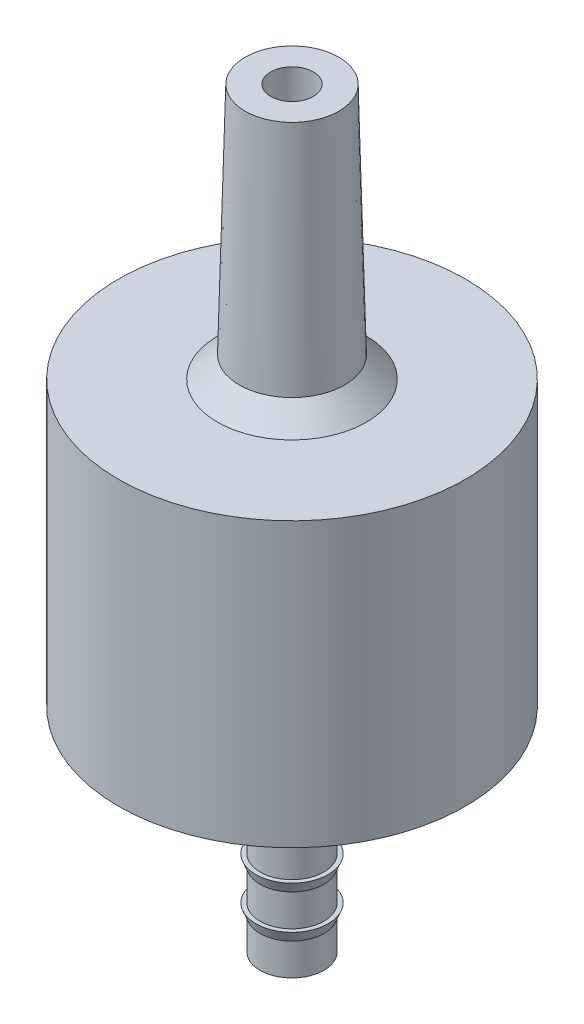
from build123d import *


with BuildPart() as part:
    # Esboço1 → Revolução1 (revolve)
    with BuildSketch(Plane.XY, mode=Mode.PRIVATE) as revolu_o1_sk:
        Polygon((2.5, 0), (8.15, 0), (8.15, -13.3), (1.5, -13.3), (1.5, -15.3), (1.7, -15.3), (1.5, -15.8), (1.5, -17.3), (1.7, -17.3), (1.5, -17.8), (1.5, -19.3), (1.7, -19.3), (1.5, -19.8), (1.5, -21.3), (1.7, -21.3), (1.5, -21.8), (1.5, -23.3), (1, -23.3), (1.25, 0), (1, 12), (2.2, 12), align=None)
    revolve(revolu_o1_sk.sketch.rotate(Axis((0, 23.058079528, 0), (0, -1, 0)), 90), axis=Axis((0, 23.058079528, 0), (0, -1, 0)))

    # Esboço2 → Revolução2 (revolve)
    with BuildSketch(Plane.XY, mode=Mode.PRIVATE) as revolu_o2_sk:
        Polygon((1.5, -14.8), (2.5, -13.3), (1.5, -13.3), align=None)
        Polygon((2.5, 0), (2.475007809, 0.999687646), (3.5, 0), align=None)
    revolve(revolu_o2_sk.sketch.rotate(Axis((0, 0.658037097, 0), (0, -1, 0)), 270), axis=Axis((0, 0.658037097, 0), (0, -1, 0)))


solid = part.part
